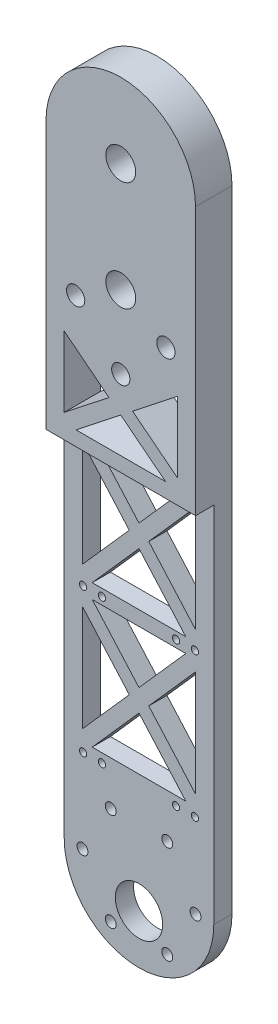
from build123d import *

# Parameters (mm, degrees)
SKETCH_1_R               = 20.5
SKETCH_1_R_2             = 6.5
SKETCH_1_R_3             = 1.5
EXTRUDE_1_DEPTH          = 10
SKETCH_2_R               = 4.1
CUT_EXTRUDE_1_DEPTH      = 10
SKETCH_4_W               = 41
SKETCH_4_H               = 120.125
CUT_EXTRUDE_3_DEPTH      = 5
CUT_EXTRUDE_4_DEPTH      = 195.839677684
CUT_EXTRUDE_4_DEPTH_BACK = 10
CUT_EXTRUDE_5_DEPTH      = 195.839677684
CUT_EXTRUDE_5_DEPTH_BACK = 10
SKETCH_5_R               = 1
CUT_EXTRUDE_6_DEPTH      = 195.647116598
SKETCH_6_R               = 2.5
CUT_EXTRUDE_7_DEPTH      = 10
CUT_EXTRUDE_START        = -10
SKETCH_7_R               = 5
CUT_EXTRUDE_8_DEPTH      = 1.8
FILLET_1_R               = 0.2


with BuildPart() as part:
    # 스케치1 → 보스-돌출1 (new body)
    # profile 1 of 3: a face of its own
    with BuildSketch(Plane.XY):
        with BuildLine():
            Line((-20.5, 173), (-20.5, 0))
            ThreePointArc((-20.5, 0), (0, 20.5), (20.5, 0))
            Line((20.5, 0), (20.5, 173))
            ThreePointArc((20.5, 173), (0, 152.5), (-20.5, 173))
        make_face()
    # profile 2 of 3: a face of its own
    with BuildSketch(Plane.XY):
        with Locations((0, 173)):
            Circle(SKETCH_1_R)
    # profile 3 of 3: a face of its own
    with BuildSketch(Plane.XY):
        Circle(SKETCH_1_R)
        with Locations((0, -7)):
            Circle(SKETCH_1_R_2, mode=Mode.SUBTRACT)
        with Locations((-7.75, -13.423393759)):
            Circle(SKETCH_1_R_3, mode=Mode.SUBTRACT)
        with Locations((7.75, -13.423393759)):
            Circle(SKETCH_1_R_3, mode=Mode.SUBTRACT)
        with Locations((15.5, 0)):
            Circle(SKETCH_1_R_3, mode=Mode.SUBTRACT)
        with Locations((7.75, 13.423393759)):
            Circle(SKETCH_1_R_3, mode=Mode.SUBTRACT)
        with Locations((-7.75, 13.423393759)):
            Circle(SKETCH_1_R_3, mode=Mode.SUBTRACT)
        with Locations((-15.5, 0)):
            Circle(SKETCH_1_R_3, mode=Mode.SUBTRACT)
    extrude(amount=-EXTRUDE_1_DEPTH)

    # 스케치2 → 컷-돌출1 (cut)
    with BuildSketch(Plane.XY):
        with Locations((0, 173)):
            Circle(SKETCH_2_R)
        with Locations((0, 143)):
            Circle(SKETCH_2_R)
    extrude(amount=-CUT_EXTRUDE_1_DEPTH, mode=Mode.SUBTRACT)

    # 스케치4 → 컷-돌출3 (cut)
    with BuildSketch(Plane.XY):
        with Locations((0, 39.5625)):
            Rectangle(SKETCH_4_W, SKETCH_4_H)
    extrude(amount=-CUT_EXTRUDE_3_DEPTH, mode=Mode.SUBTRACT)

    # 스케치3 → 컷-돌출4 (cut, two sides: drawn at the far end of the back side and taken through both)
    with BuildSketch(Plane.XY.offset(-CUT_EXTRUDE_4_DEPTH_BACK)):
        Polygon((15.5, 125.455788946), (3.235714571, 115.8125), (15.5, 106.169211054), align=None)
        Polygon((12.264285429, 103.625), (0, 113.268288946), (-12.264285429, 103.625), align=None)
        Polygon((-3.235714571, 115.8125), (-15.5, 125.455788946), (-15.5, 106.169211054), align=None)
    extrude(amount=CUT_EXTRUDE_4_DEPTH + CUT_EXTRUDE_4_DEPTH_BACK, mode=Mode.SUBTRACT)

    # 스케치3<4> → 컷-돌출5 (cut, two sides: drawn at the far end of the back side and taken through both)
    with BuildSketch(Plane.XY.offset(-CUT_EXTRUDE_5_DEPTH_BACK)):
        Polygon((12.830480138, 99.625), (-12.830480138, 99.625), (0, 85.112071418), align=None)
        Polygon((15.5, 67.579571418), (15.5, 96.605428582), (2.669519862, 82.0925), align=None)
        Polygon((12.830480138, 64.56), (0, 79.072928582), (-12.830480138, 64.56), align=None)
        Polygon((-2.669519862, 82.0925), (-15.5, 96.605428582), (-15.5, 67.579571418), align=None)
        Polygon((12.830313114, 60.56), (-12.830313114, 60.56), (0, 46.049329749), align=None)
        Polygon((-2.669686886, 43.03), (-15.5, 57.540670251), (-15.5, 28.519329749), align=None)
        Polygon((12.830313114, 25.5), (0, 40.010670251), (-12.830313114, 25.5), align=None)
        Polygon((15.5, 28.519329749), (15.5, 57.540670251), (2.669686886, 43.03), align=None)
    extrude(amount=CUT_EXTRUDE_5_DEPTH + CUT_EXTRUDE_5_DEPTH_BACK, mode=Mode.SUBTRACT)

    # 스케치5 → 컷-돌출6 (cut, through all)
    with BuildSketch(Plane.XY.offset(-5)):
        with Locations((-15.33, 23)):
            Circle(SKETCH_5_R)
        with Locations((-10.16, 23)):
            Circle(SKETCH_5_R)
        with Locations((10.16, 23)):
            Circle(SKETCH_5_R)
        with Locations((15.33, 23)):
            Circle(SKETCH_5_R)
        with Locations((-15.33, 62.56)):
            Circle(SKETCH_5_R)
        with Locations((-10.16, 62.56)):
            Circle(SKETCH_5_R)
        with Locations((10.16, 62.56)):
            Circle(SKETCH_5_R)
        with Locations((15.33, 62.56)):
            Circle(SKETCH_5_R)
    extrude(amount=-CUT_EXTRUDE_6_DEPTH, mode=Mode.SUBTRACT)

    # 스케치6 → 컷-돌출7 (cut)
    with BuildSketch(Plane.XY):
        with Locations((-12.37, 135.5)):
            Circle(SKETCH_6_R)
        with Locations((12.375, 135.5)):
            Circle(SKETCH_6_R)
        with Locations((0, 123)):
            Circle(SKETCH_6_R)
    extrude(amount=-CUT_EXTRUDE_7_DEPTH, mode=Mode.SUBTRACT)

    # 스케치7 → 컷-돌출8 (cut)
    with BuildSketch(Plane.XY.offset(CUT_EXTRUDE_START)):
        with Locations((0, 173)):
            Circle(SKETCH_7_R)
        with Locations((0, 143)):
            Circle(SKETCH_7_R)
    extrude(amount=CUT_EXTRUDE_8_DEPTH, mode=Mode.SUBTRACT)

    # 필렛1
    fillet_1_edges = [part.edges().sort_by_distance(p)[0] for p in [
        (-4.1, 173, -8.2),
        (-5, 173, -10),
        (-4.1, 143, -8.2),
        (-5, 143, -10),
    ]]
    fillet(fillet_1_edges, radius=FILLET_1_R)


solid = part.part
